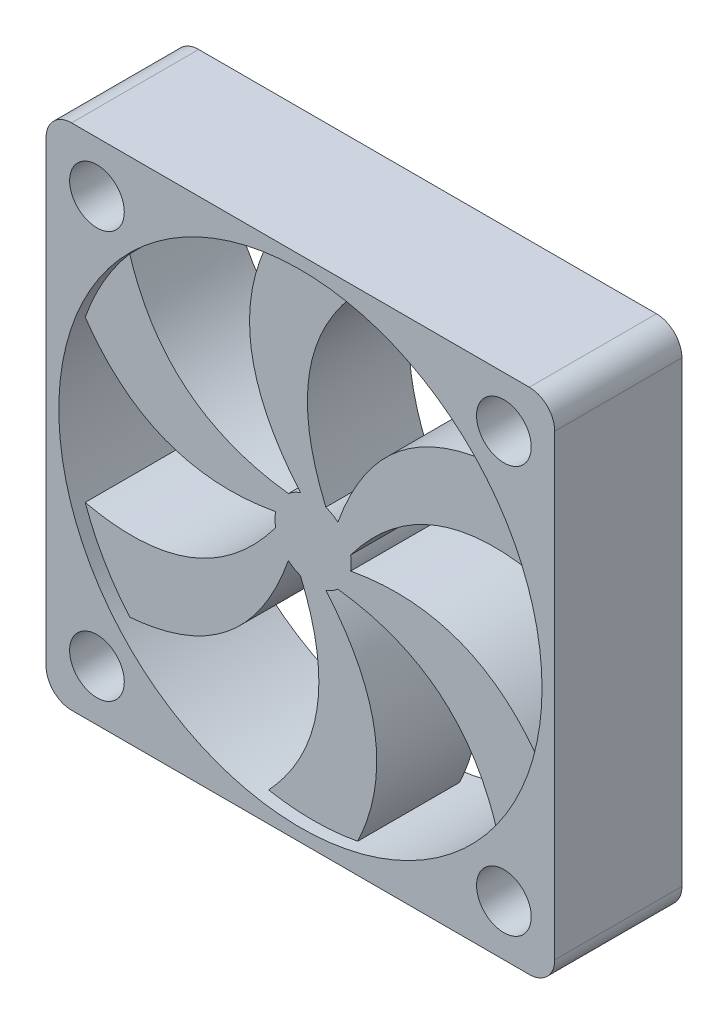
from build123d import *

# Parameters (mm, degrees)
SKETCH1_R           = 2.15
BOSS_EXTRUDE1_DEPTH = 5
BOSS_EXTRUDE2_DEPTH = 4


with BuildPart() as part:
    # Sketch1 → Boss-Extrude1 (new, symmetric)
    with BuildSketch(Plane.XY):
        with BuildLine():
            ThreePointArc((-20, -18), (-19.414213562, -19.414213562), (-18, -20))
            Line((-18, -20), (18, -20))
            ThreePointArc((18, -20), (19.414213562, -19.414213562), (20, -18))
            Line((20, -18), (20, 18))
            ThreePointArc((20, 18), (19.414213562, 19.414213562), (18, 20))
            Line((18, 20), (-18, 20))
            ThreePointArc((-18, 20), (-19.414213562, 19.414213562), (-20, 18))
            Line((-20, 18), (-20, -18))
        make_face()
        with Locations((-16, -16)):
            Circle(SKETCH1_R, mode=Mode.SUBTRACT)
        with Locations((16, -16)):
            Circle(SKETCH1_R, mode=Mode.SUBTRACT)
        with BuildLine():
            ThreePointArc((17.92289399, 6.306335785), (18.728787812, 3.19882902), (19, 0))
            ThreePointArc((19, 0), (18.728787812, -3.19882902), (17.92289399, -6.306335785))
            ThreePointArc((17.92289399, -6.306335785), (16.454482672, -9.5), (14.42289399, -12.368513612))
            ThreePointArc((14.42289399, -12.368513612), (9.5, -16.454482672), (3.5, -18.674849397))
            ThreePointArc((3.5, -18.674849397), (0, -19), (-3.5, -18.674849397))
            ThreePointArc((-3.5, -18.674849397), (-9.5, -16.454482672), (-14.42289399, -12.368513612))
            ThreePointArc((-14.42289399, -12.368513612), (-16.454482672, -9.5), (-17.92289399, -6.306335785))
            ThreePointArc((-17.92289399, -6.306335785), (-19, 0), (-17.92289399, 6.306335785))
            ThreePointArc((-17.92289399, 6.306335785), (-16.454482672, 9.5), (-14.42289399, 12.368513612))
            ThreePointArc((-14.42289399, 12.368513612), (-9.5, 16.454482672), (-3.5, 18.674849397))
            ThreePointArc((-3.5, 18.674849397), (0, 19), (3.5, 18.674849397))
            ThreePointArc((3.5, 18.674849397), (9.5, 16.454482672), (14.42289399, 12.368513612))
            ThreePointArc((14.42289399, 12.368513612), (16.454482672, 9.5), (17.92289399, 6.306335785))
        make_face(mode=Mode.SUBTRACT)
        with Locations((-16, 16)):
            Circle(SKETCH1_R, mode=Mode.SUBTRACT)
        with Locations((16, 16)):
            Circle(SKETCH1_R, mode=Mode.SUBTRACT)
    extrude(amount=BOSS_EXTRUDE1_DEPTH, both=True)

    # Sketch1<5> → Boss-Extrude2 (add, symmetric)
    with BuildSketch(Plane.XY):
        with BuildLine():
            add(Edge.make_bspline(
                [(2.949489743, 0.548188159), (8.845203175, 8.391149402), (17.92289399, 6.306335785)],
                knots=[0, 0, 0, 1, 1, 1], degree=2))
            ThreePointArc((17.92289399, 6.306335785), (16.454482672, 9.5), (14.42289399, 12.368513612))
            add(Edge.make_bspline(
                [(1.949489743, 2.280238966), (5.266917454, 11.646464502), (14.42289399, 12.368513612)],
                knots=[0, 0, 0, 1, 1, 1], degree=2))
            ThreePointArc((1.949489743, 2.280238966), (1.5, 2.598076211), (1, 2.828427125))
            add(Edge.make_bspline(
                [(1, 2.828427125), (-1.258927409, 8.1328538), (0, 12.674849397)],
                knots=[0, 0, 0, 0.587597174, 0.587597174, 0.587597174], degree=2))
            add(Edge.make_bspline(
                [(0, 12.674849397), (0.883573382, 15.862631615), (3.5, 18.674849397)],
                knots=[0.587597174, 0.587597174, 0.587597174, 1, 1, 1], degree=2))
            ThreePointArc((3.5, 18.674849397), (0, 19), (-3.5, 18.674849397))
            add(Edge.make_bspline(
                [(-1, 2.828427125), (-7.452675396, 10.384516566), (-3.5, 18.674849397)],
                knots=[0, 0, 0, 1, 1, 1], degree=2))
            ThreePointArc((-1, 2.828427125), (-1.5, 2.598076211), (-1.949489743, 2.280238966))
            add(Edge.make_bspline(
                [(-1.949489743, 2.280238966), (-11.689550136, 3.46459595), (-14.42289399, 12.368513612)],
                knots=[0, 0, 0, 1, 1, 1], degree=2))
            ThreePointArc((-14.42289399, 12.368513612), (-16.454482672, 9.5), (-17.92289399, 6.306335785))
            add(Edge.make_bspline(
                [(-2.949489743, 0.548188159), (-12.71959285, -1.261947936), (-17.92289399, 6.306335785)],
                knots=[0, 0, 0, 1, 1, 1], degree=2))
            ThreePointArc((-2.949489743, 0.548188159), (-3, 0), (-2.949489743, -0.548188159))
            add(Edge.make_bspline(
                [(-2.949489743, -0.548188159), (-8.845203175, -8.391149402), (-17.92289399, -6.306335785)],
                knots=[0, 0, 0, 1, 1, 1], degree=2))
            ThreePointArc((-17.92289399, -6.306335785), (-16.454482672, -9.5), (-14.42289399, -12.368513612))
            add(Edge.make_bspline(
                [(-1.949489743, -2.280238966), (-5.266917454, -11.646464502), (-14.42289399, -12.368513612)],
                knots=[0, 0, 0, 1, 1, 1], degree=2))
            ThreePointArc((-1.949489743, -2.280238966), (-1.5, -2.598076211), (-1, -2.828427125))
            add(Edge.make_bspline(
                [(-1, -2.828427125), (2.844346961, -11.855745352), (-3.5, -18.674849397)],
                knots=[0, 0, 0, 1, 1, 1], degree=2))
            ThreePointArc((-3.5, -18.674849397), (0, -19), (3.5, -18.674849397))
            add(Edge.make_bspline(
                [(1, -2.828427125), (7.452675396, -10.384516566), (3.5, -18.674849397)],
                knots=[0, 0, 0, 1, 1, 1], degree=2))
            ThreePointArc((1, -2.828427125), (1.5, -2.598076211), (1.949489743, -2.280238966))
            add(Edge.make_bspline(
                [(1.949489743, -2.280238966), (11.689550136, -3.46459595), (14.42289399, -12.368513612)],
                knots=[0, 0, 0, 1, 1, 1], degree=2))
            ThreePointArc((14.42289399, -12.368513612), (16.454482672, -9.5), (17.92289399, -6.306335785))
            add(Edge.make_bspline(
                [(2.949489743, -0.548188159), (12.71959285, 1.261947936), (17.92289399, -6.306335785)],
                knots=[0, 0, 0, 1, 1, 1], degree=2))
            ThreePointArc((2.949489743, -0.548188159), (3, 0), (2.949489743, 0.548188159))
        make_face()
    extrude(amount=BOSS_EXTRUDE2_DEPTH, both=True)


solid = part.part
